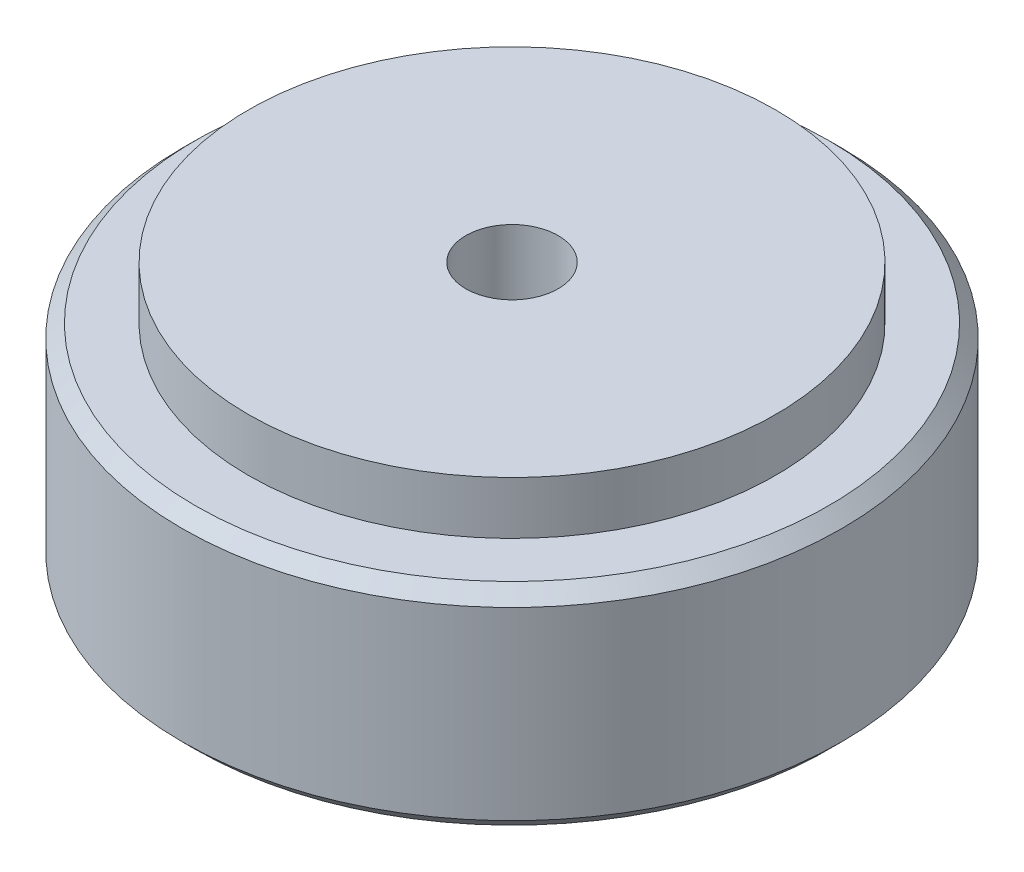
from build123d import *

# Parameters (mm, degrees)
SKETCH1_R           = 12.5
BOSS_EXTRUDE1_DEPTH = 8
SKETCH2_R           = 10
BOSS_EXTRUDE2_DEPTH = 2
CUT_EXTRUDE1_REACH  = 22.31
SKETCH3_R           = 1.75
SKETCH4_R           = 3
CUT_EXTRUDE2_DEPTH  = 5
SKETCH5_R           = 9
SKETCH5_R_2         = 8
BOSS_EXTRUDE3_DEPTH = 1.5
CHAMFER1_SIZE       = 0.5


with BuildPart() as part:
    # Sketch1 → Boss-Extrude1 (new body)
    with BuildSketch(Plane(origin=(0, 0, 0), x_dir=(1, 0, 0), z_dir=(0, 1, 0))):
        with Locations(Location((0, 0, 0), (0, 0, 270))):
            Circle(SKETCH1_R)
    extrude(amount=BOSS_EXTRUDE1_DEPTH)

    # Sketch2 → Boss-Extrude2 (add)
    with BuildSketch(Plane(origin=(0, 8, 0), x_dir=(1, 0, 0), z_dir=(0, 1, 0))):
        with Locations(Location((0, 0, 0), (0, 0, 270))):
            Circle(SKETCH2_R)
    extrude(amount=BOSS_EXTRUDE2_DEPTH)

    # Sketch3 → Cut-Extrude1 (cut, up to next)
    with BuildSketch(Plane(origin=(0, 10, 0), x_dir=(1, 0, 0), z_dir=(0, 1, 0)), mode=Mode.PRIVATE) as cut_extrude1_sk1:
        with Locations(Location((0, 0, 0), (0, 0, 270))):
            Circle(SKETCH3_R)
    cut_extrude1_tool1 = extrude(cut_extrude1_sk1.sketch, amount=-CUT_EXTRUDE1_REACH, mode=Mode.PRIVATE) & part.part
    add(cut_extrude1_tool1.solids().sort_by_distance((0, 10, 0))[0], mode=Mode.SUBTRACT)

    # Sketch4 → Cut-Extrude2 (cut)
    with BuildSketch(Plane.XZ):
        with Locations(Location((0, 0, 0), (0, 0, 270))):
            Circle(SKETCH4_R)
    extrude(amount=-CUT_EXTRUDE2_DEPTH, mode=Mode.SUBTRACT)

    # Sketch5 → Boss-Extrude3 (add)
    with BuildSketch(Plane.XZ):
        with Locations(Location((0, 0, 0), (0, 0, 90))):
            Circle(SKETCH5_R)
        with Locations(Location((0, 0, 0), (0, 0, 270))):
            Circle(SKETCH5_R_2, mode=Mode.SUBTRACT)
    extrude(amount=BOSS_EXTRUDE3_DEPTH)

    # Chamfer1
    chamfer1_edges = [part.edges().sort_by_distance(p)[0] for p in [
        (0, 0, -12.5),
        (0, 8, -12.5),
    ]]
    chamfer(chamfer1_edges, length=CHAMFER1_SIZE)


solid = part.part
